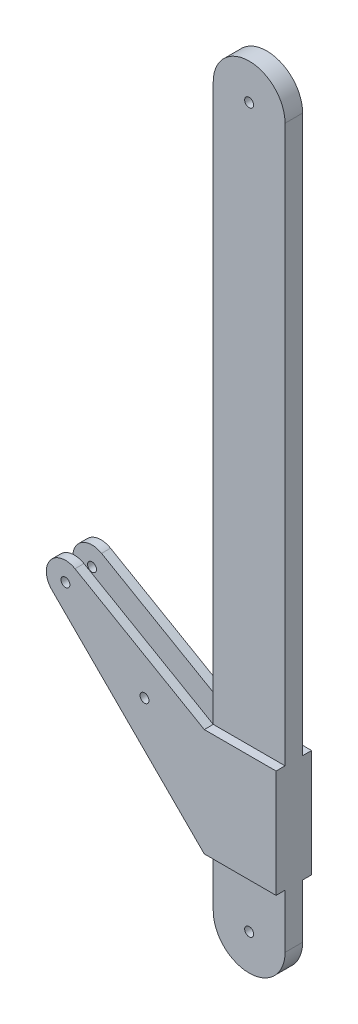
from build123d import *

# Parameters (mm, degrees)
SKETCH1_R           = 1.25
BOSS_EXTRUDE2_DEPTH = 2.45
SKETCH4_R           = 1.25
BOSS_EXTRUDE4_DEPTH = 2.5


with BuildPart() as part:
    # Sketch1 → Boss-Extrude2 (new, symmetric)
    with BuildSketch(Plane.XY):
        with BuildLine():
            Line((-10, -100), (-10, 100))
            ThreePointArc((-10, 100), (0, 110), (10, 100))
            Line((10, 100), (10, -100))
            ThreePointArc((10, -100), (0, -110), (-10, -100))
        make_face()
        with Locations((0, 100)):
            Circle(SKETCH1_R, mode=Mode.SUBTRACT)
        with Locations((0, -100)):
            Circle(SKETCH1_R, mode=Mode.SUBTRACT)
    extrude(amount=BOSS_EXTRUDE2_DEPTH, both=True)

    # Sketch4 → Boss-Extrude4 (add)
    with BuildSketch(Plane.XY.offset(2.45)):
        with BuildLine():
            Line((-10, -85), (-52.426406871, -42.573593129))
            ThreePointArc((-52.426406871, -42.573593129), (-52.884926821, -35.577930556), (-46.008961975, -34.210216111))
            Line((-46.008961975, -34.210216111), (-10, -55))
            Line((-10, -55), (10, -55))
            Line((10, -55), (10, -85))
            Line((10, -85), (-10, -85))
        make_face()
        with Locations((-48.667154687, -38.814340944)):
            Circle(SKETCH4_R, mode=Mode.SUBTRACT)
        with Locations((-26.645631723, -55.712049831)):
            Circle(SKETCH4_R, mode=Mode.SUBTRACT)
    boss_extrude4 = extrude(amount=BOSS_EXTRUDE4_DEPTH)

    # Mirror1: Boss-Extrude4 across plane
    add(boss_extrude4.mirror(Plane.XY))


solid = part.part
